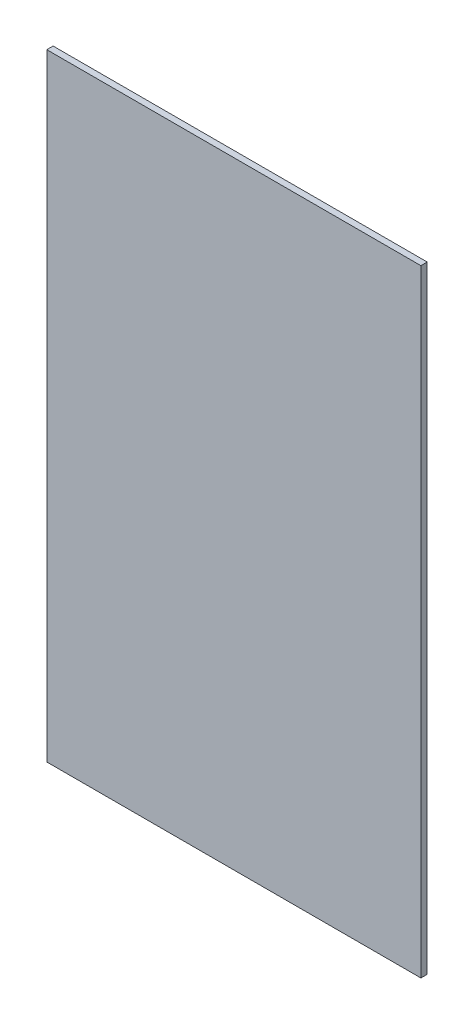
from build123d import *

# Parameters (mm, degrees)
SKETCH1_W           = 177.165
SKETCH1_H           = 292.1
BOSS_EXTRUDE1_DEPTH = 2.9972


with BuildPart() as part:
    # Sketch1 → Boss-Extrude1 (new body)
    with BuildSketch(Plane.XY):
        Rectangle(SKETCH1_W, SKETCH1_H)
    extrude(amount=BOSS_EXTRUDE1_DEPTH)


solid = part.part
